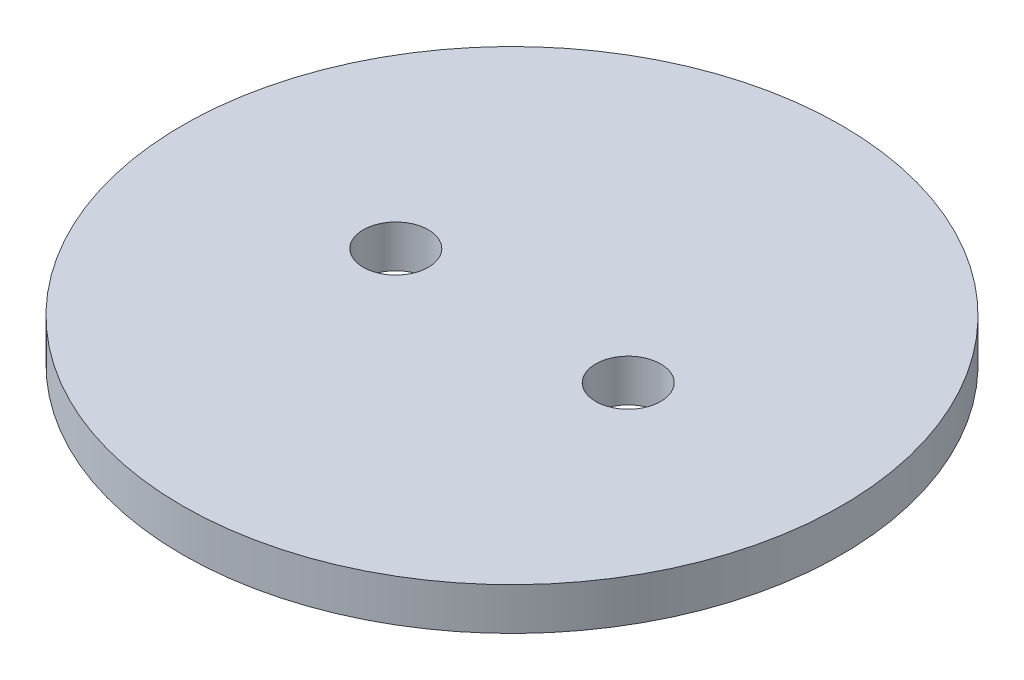
from build123d import *

# Parameters (mm, degrees)
SKETCH1_R           = 49.53
BOSS_EXTRUDE1_DEPTH = 6.35
SKETCH2_R           = 4.8895
CUT_EXTRUDE1_DEPTH  = 71.33323752


with BuildPart() as part:
    # Sketch1 → Boss-Extrude1 (new body)
    with BuildSketch(Plane(origin=(0, 0, 0), x_dir=(1, 0, 0), z_dir=(0, 1, 0))):
        with Locations(Location((0, 0, 0), (0, 0, 270))):
            Circle(SKETCH1_R)
    extrude(amount=BOSS_EXTRUDE1_DEPTH)

    # Sketch2 → Cut-Extrude1 (cut, through all)
    with BuildSketch(Plane(origin=(0, 6.35, 0), x_dir=(1, 0, 0), z_dir=(0, 1, 0))):
        with Locations(Location((-17.4625, 0, 0), (0, 0, 270))):
            Circle(SKETCH2_R)
        with Locations(Location((17.4625, 0, 0), (0, 0, 270))):
            Circle(SKETCH2_R)
    extrude(amount=-CUT_EXTRUDE1_DEPTH, mode=Mode.SUBTRACT)


solid = part.part
